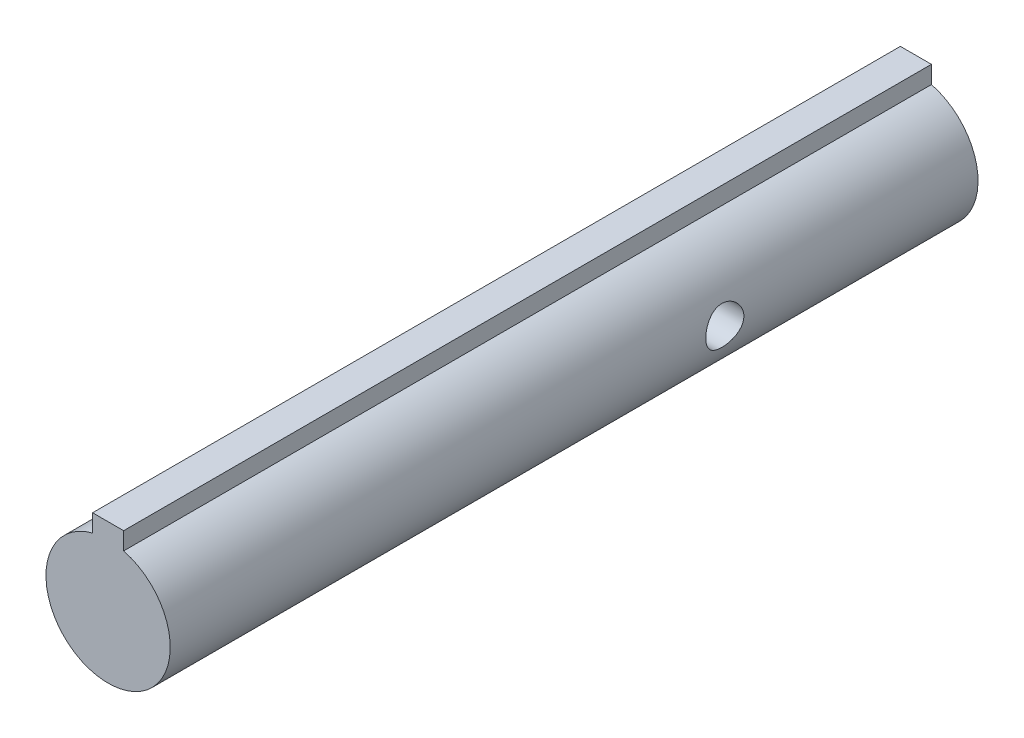
from build123d import *

# Parameters (mm, degrees)
BOSS_EXTRUDE1_DEPTH = 52
SKETCH2_R           = 1.225
CUT_EXTRUDE1_DEPTH  = 25


with BuildPart() as part:
    # Sketch1 → Boss-Extrude1 (new body)
    with BuildSketch(Plane.XY):
        with BuildLine():
            Line((-1, 3.872983346), (-1, 5.002983346))
            Line((-1, 5.002983346), (1, 5.002983346))
            Line((1, 5.002983346), (1, 3.872983346))
            ThreePointArc((1, 3.872983346), (0, -4), (-1, 3.872983346))
        make_face()
    extrude(amount=BOSS_EXTRUDE1_DEPTH)

    # Sketch2 → Cut-Extrude1 (cut, symmetric)
    with BuildSketch(Plane(origin=(0, 0, 0), x_dir=(0, 0, -1), z_dir=(1, 0, 0))):
        with Locations((-16.3, 0)):
            Circle(SKETCH2_R)
    extrude(amount=CUT_EXTRUDE1_DEPTH, both=True, mode=Mode.SUBTRACT)


solid = part.part
